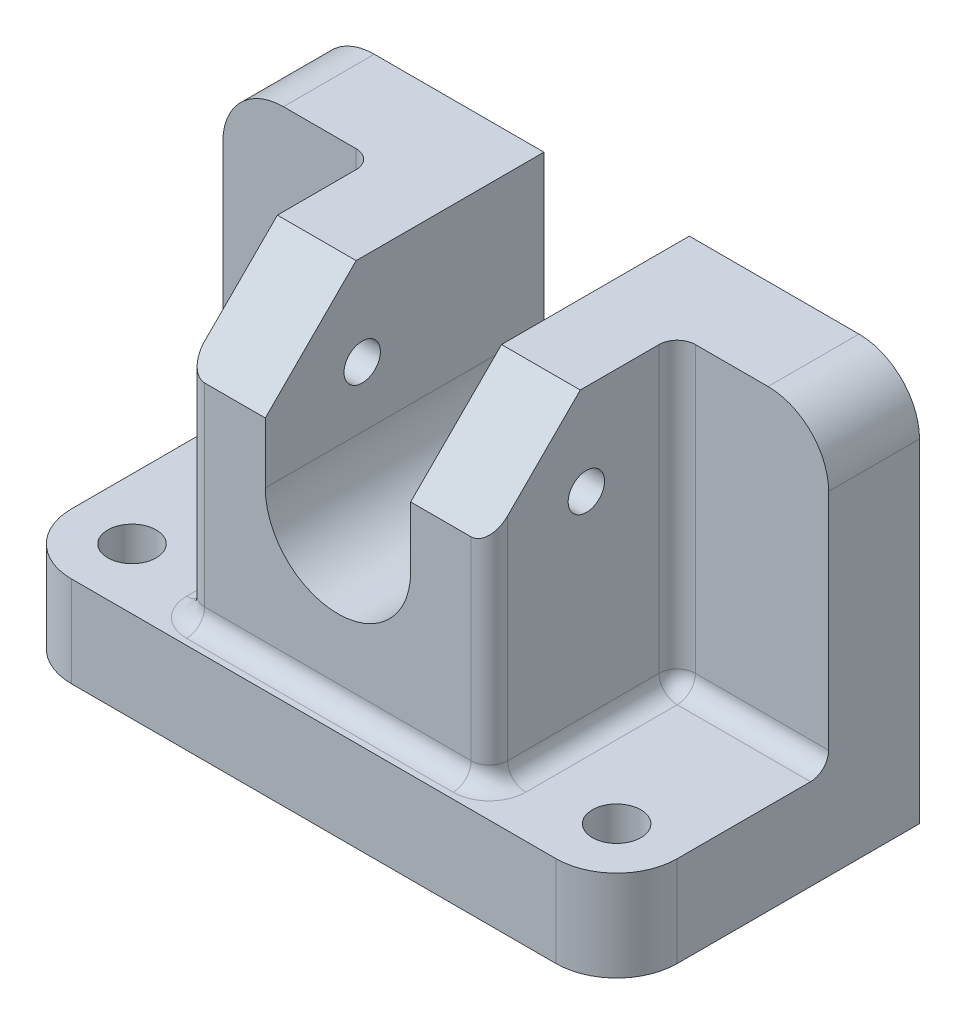
from build123d import *

# Parameters (mm, degrees)
SKETCH1_W                = 100
SKETCH1_H                = 65
BASE_EXTRUDE_DEPTH       = 50
SKETCH2_W                = 35
SKETCH2_H                = 50
CUT_EXTRUDE1_DEPTH       = 130.325171564
SKETCH3_W                = 50
SKETCH3_H                = 31
BOSS_EXTRUDE1_DEPTH      = 50
CUT_EXTRUDE2_DEPTH       = 95.026591983
CHAMFER1_SIZE            = 15
FILLET1_R                = 10
FILLET2_R                = 3
FILLET3_R                = 3
FILLET4_R                = 3
F_8_0_8_DIAMETER_HOLE1_D = 8
F_6_0_6_DIAMETER_HOLE1_D = 6


with BuildPart() as part:
    # Sketch1 → Base-Extrude (new body)
    with BuildSketch(Plane.XY):
        with Locations((0, 32.5)):
            Rectangle(SKETCH1_W, SKETCH1_H)
    extrude(amount=BASE_EXTRUDE_DEPTH)

    # Sketch2 → Cut-Extrude1 (cut, through all)
    with BuildSketch(Plane(origin=(50, 0, 0), x_dir=(0, 0, -1), z_dir=(1, 0, 0))):
        with Locations((-32.5, 40)):
            Rectangle(SKETCH2_W, SKETCH2_H)
    extrude(amount=-CUT_EXTRUDE1_DEPTH, mode=Mode.SUBTRACT)

    # Sketch3 → Boss-Extrude1 (add)
    with BuildSketch(Plane(origin=(0, 15, 0), x_dir=(-1, 0, 0), z_dir=(0, 1, 0))):
        with Locations((0, 30.5)):
            Rectangle(SKETCH3_W, SKETCH3_H)
    extrude(amount=BOSS_EXTRUDE1_DEPTH)

    # Sketch4 → Cut-Extrude2 (cut, through all)
    with BuildSketch(Plane.XY.offset(46)):
        with BuildLine():
            Line((-12, 65), (-12, 40))
            ThreePointArc((-12, 40), (0, 28), (12, 40))
            Line((12, 40), (12, 65))
            Line((12, 65), (-12, 65))
        make_face()
    extrude(amount=-CUT_EXTRUDE2_DEPTH, mode=Mode.SUBTRACT)

    # Chamfer1
    chamfer1_edges = [part.edges().sort_by_distance(p)[0] for p in [
        (18.5, 65, 46),
        (-18.5, 65, 46),
    ]]
    chamfer(chamfer1_edges, length=CHAMFER1_SIZE)

    # Fillet1
    fillet1_edges = [part.edges().sort_by_distance(p)[0] for p in [
        (50, 7.5, 50),
        (-50, 7.5, 50),
        (-50, 65, 7.5),
        (50, 65, 7.5),
    ]]
    fillet(fillet1_edges, radius=FILLET1_R)

    # Fillet2
    fillet2_edges = [part.edges().sort_by_distance(p)[0] for p in [
        (25, 40, 15),
        (-25, 40, 15),
    ]]
    fillet(fillet2_edges, radius=FILLET2_R)

    # Fillet3
    fillet3_edges = [part.edges().sort_by_distance(p)[0] for p in [
        (-25, 32.5, 46),
        (25, 32.5, 46),
    ]]
    fillet(fillet3_edges, radius=FILLET3_R)

    # Fillet4
    fillet4_edges = [part.edges().sort_by_distance(p)[0] for p in [
        (0, 15, 46),
        (25, 15, 30.5),
        (-24.121320344, 15, 45.121320344),
        (24.121320344, 15, 45.121320344),
        (-39, 15, 15),
        (39, 15, 15),
        (-25, 15, 30.5),
        (-25.878679656, 15, 15.878679656),
        (25.878679656, 15, 15.878679656),
    ]]
    fillet(fillet4_edges, radius=FILLET4_R)

    # Ø8.0 (8) Diameter Hole1 (through all)
    with Locations(Plane(origin=(0, 15, 0), x_dir=(1, 0, 0), z_dir=(0, 1, 0))):
        with Locations((40, -40), (-40, -40)):
            Hole(F_8_0_8_DIAMETER_HOLE1_D / 2)

    # Ø6.0 (6) Diameter Hole1 (through all)
    with Locations(Plane(origin=(25, 0, 0), x_dir=(0, 0, -1), z_dir=(1, 0, 0))):
        with Locations((-30, 50)):
            Hole(F_6_0_6_DIAMETER_HOLE1_D / 2)


solid = part.part
